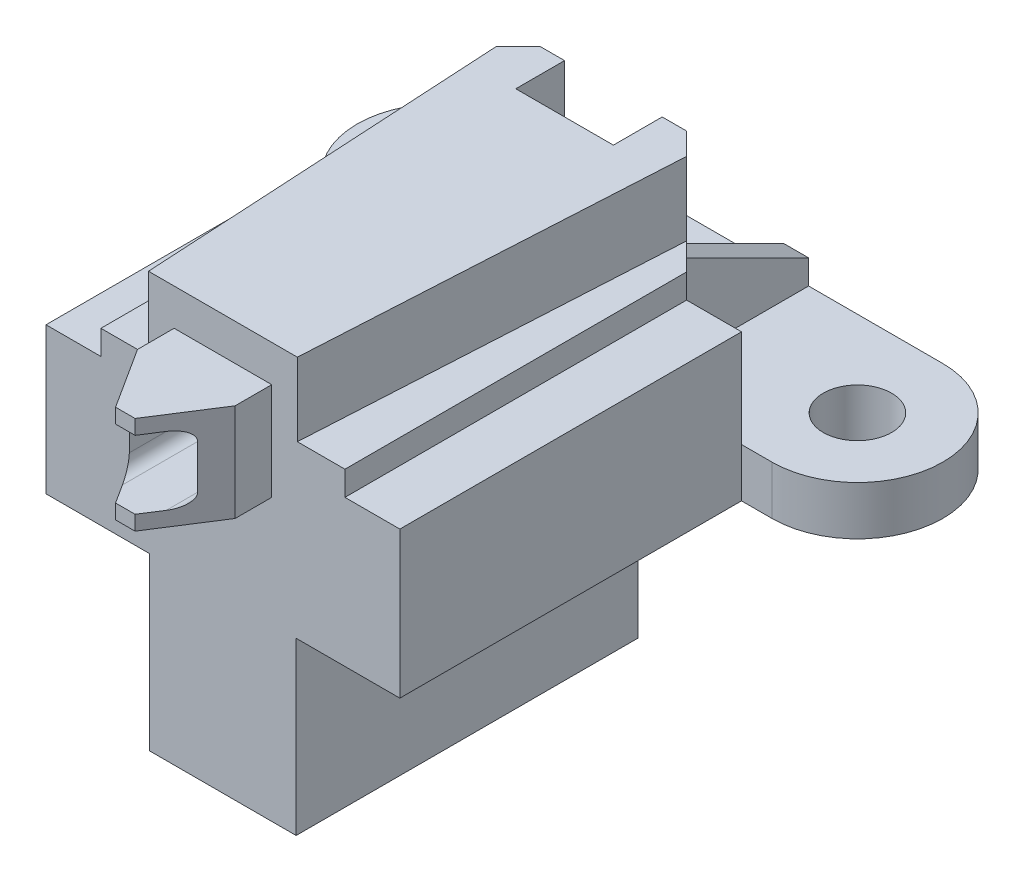
from build123d import *

# Parameters (mm, degrees)
SZKIC1_R                    = 1.4
DODANIE_WYCI_GNI_CIE1_DEPTH = 2
SZKIC1_3_W                  = 4.25
SZKIC1_3_H                  = 14
DODANIE_WYCI_GNI_CIE2_DEPTH = 7
DODANIE_WYCI_GNI_CIE3_DEPTH = 7
SZKIC2_W                    = 10
SZKIC2_H                    = 14
DODANIE_WYCI_GNI_CIE4_DEPTH = 3
DODANIE_WYCI_GNI_CIE5_START = 2
SZKIC1_5_W                  = 1
SZKIC1_5_H                  = 7
DODANIE_WYCI_GNI_CIE5_DEPTH = 3.5
DODANIE_WYCI_GNI_CIE6_REACH = 30.417
WYTNIJ_WYCI_GNI_CIE1_REACH  = 27.125
WYTNIJ_WYCI_GNI_CIE2_DEPTH  = 3
SZKIC6_W                    = 2.25
SZKIC6_H                    = 14
WYTNIJ_WYCI_GNI_CIE3_DEPTH  = 1
SZKIC7_W                    = 4
SZKIC7_H                    = 4
DODANIE_WYCI_GNI_CIE7_DEPTH = 4
WYTNIJ_WYCI_GNI_CIE4_DEPTH  = 4
WYTNIJ_WYCI_GNI_CIE5_DEPTH  = 34.841542518


with BuildPart() as part:
    # Szkic1 → Dodanie-wyciągnięcie1 (new body)
    with BuildSketch(Plane(origin=(0, 0, 0), x_dir=(1, 0, 0), z_dir=(0, 1, 0))):
        with BuildLine():
            Line((-17, 3.5), (0, 3.5))
            ThreePointArc((0, 3.5), (3.5, 0), (0, -3.5))
            Line((0, -3.5), (-17, -3.5))
            ThreePointArc((-17, -3.5), (-20.5, 0), (-17, 3.5))
        make_face()
        with Locations(Location((-17, 0, 0), (0, 0, 270))):
            Circle(SZKIC1_R, mode=Mode.SUBTRACT)
        with Locations(Location((0, 0, 0), (0, 0, 270))):
            Circle(SZKIC1_R, mode=Mode.SUBTRACT)
    extrude(amount=DODANIE_WYCI_GNI_CIE1_DEPTH)

    # Szkic1<3> → Dodanie-wyciągnięcie2 (add)
    with BuildSketch(Plane(origin=(0, 0, 0), x_dir=(1, 0, 0), z_dir=(0, 1, 0))):
        with Locations((-13.625, -10.5)):
            Rectangle(SZKIC1_3_W, SZKIC1_3_H)
        Polygon((-10.5, -3.5), (-11.5, -3.5), (-11.5, -17.5), (-5.5, -17.5), (-5.5, -3.5), (-6.5, -3.5), align=None)
        with Locations((-3.375, -10.5)):
            Rectangle(SZKIC1_3_W, SZKIC1_3_H)
    extrude(amount=DODANIE_WYCI_GNI_CIE2_DEPTH)

    # Szkic1<4> → Dodanie-wyciągnięcie3 (add)
    with BuildSketch(Plane(origin=(0, 0, 0), x_dir=(1, 0, 0), z_dir=(0, 1, 0))):
        Polygon((-10.5, -3.5), (-11.5, -3.5), (-11.5, -17.5), (-5.5, -17.5), (-5.5, -3.5), (-6.5, -3.5), align=None)
    extrude(amount=-DODANIE_WYCI_GNI_CIE3_DEPTH)

    # Szkic2 → Dodanie-wyciągnięcie4 (add)
    with BuildSketch(Plane(origin=(0, 7, 0), x_dir=(1, 0, 0), z_dir=(0, 1, 0))):
        with Locations((-8.5, -10.5)):
            Rectangle(SZKIC2_W, SZKIC2_H)
    extrude(amount=DODANIE_WYCI_GNI_CIE4_DEPTH)

    # Szkic1<5> → Dodanie-wyciągnięcie5 (add)
    with BuildSketch(Plane(origin=(0, 0, 0), x_dir=(1, 0, 0), z_dir=(0, 1, 0)).offset(DODANIE_WYCI_GNI_CIE5_START)):
        with Locations((-6, 0)):
            Rectangle(SZKIC1_5_W, SZKIC1_5_H)
        with Locations((-11, 0)):
            Rectangle(SZKIC1_5_W, SZKIC1_5_H)
    extrude(amount=DODANIE_WYCI_GNI_CIE5_DEPTH)

    # Dodanie-wyciągnięcie6: up to this face of the body (flat: up to its plane)
    dodanie_wyci_gni_cie6_end = Plane(part.part.faces().sort_by_distance((-8.5, 10, 10.5))[0])
    # Szkic3 → Dodanie-wyciągnięcie6 (add, up to the picked face)
    with BuildSketch(Plane(origin=(0, 2, 0), x_dir=(1, 0, 0), z_dir=(0, 1, 0)), mode=Mode.PRIVATE) as dodanie_wyci_gni_cie6_sk1:
        Polygon((-3.5, -3.5), (-5.5, -1.5), (-6.5, -1.5), (-6.5, -3.5), (-5.5, -3.5), align=None)
    dodanie_wyci_gni_cie6_tool1 = split(extrude(dodanie_wyci_gni_cie6_sk1.sketch, amount=DODANIE_WYCI_GNI_CIE6_REACH, mode=Mode.PRIVATE), bisect_by=dodanie_wyci_gni_cie6_end, keep=Keep.BOTH, mode=Mode.PRIVATE)
    # Szkic3 → Dodanie-wyciągnięcie6 (add, up to the picked face)
    with BuildSketch(Plane(origin=(0, 2, 0), x_dir=(1, 0, 0), z_dir=(0, 1, 0)), mode=Mode.PRIVATE) as dodanie_wyci_gni_cie6_sk2:
        Polygon((-11.5, -3.5), (-13.5, -3.5), (-11.5, -1.5), (-10.5, -1.5), (-10.5, -3.5), align=None)
    dodanie_wyci_gni_cie6_tool2 = split(extrude(dodanie_wyci_gni_cie6_sk2.sketch, amount=DODANIE_WYCI_GNI_CIE6_REACH, mode=Mode.PRIVATE), bisect_by=dodanie_wyci_gni_cie6_end, keep=Keep.BOTH, mode=Mode.PRIVATE)
    add(dodanie_wyci_gni_cie6_tool1.solids().sort_by(Axis((-5.416667, 2, 2.666667), (0, 1, 0)))[0])
    add(dodanie_wyci_gni_cie6_tool2.solids().sort_by(Axis((-11.583333, 2, 2.666667), (0, 1, 0)))[0])

    # Wytnij-wyciągnięcie1: up to this face of the body (flat: up to its plane)
    wytnij_wyci_gni_cie1_end = Plane(part.part.faces().sort_by_distance((-5.5, 3.75, -1))[0])
    # Szkic4 → Wytnij-wyciągnięcie1 (cut, up to the picked face)
    with BuildSketch(Plane.ZY.offset(11.5), mode=Mode.PRIVATE) as wytnij_wyci_gni_cie1_sk1:
        Polygon((1.5, 5.5), (-3.5, 3), (-3.5, 5.5), align=None)
    wytnij_wyci_gni_cie1_tool1 = split(extrude(wytnij_wyci_gni_cie1_sk1.sketch, amount=-WYTNIJ_WYCI_GNI_CIE1_REACH, mode=Mode.PRIVATE), bisect_by=wytnij_wyci_gni_cie1_end, keep=Keep.BOTH, mode=Mode.PRIVATE)
    add(wytnij_wyci_gni_cie1_tool1.solids().sort_by(Axis((-11.5, 4.666667, -1.833333), (1, 0, 0)))[0], mode=Mode.SUBTRACT)

    # Szkic5 → Wytnij-wyciągnięcie2 (cut)
    with BuildSketch(Plane(origin=(0, 10, 0), x_dir=(1, 0, 0), z_dir=(0, 1, 0))):
        Polygon((-5.45, -17.5), (-3.5, -17.5), (-3.5, -3.5), (-4.600591716, -2.399408284), align=None)
        Polygon((-13.5, -3.5), (-12.399408284, -2.399408284), (-11.55, -17.5), (-13.5, -17.5), align=None)
    extrude(amount=-WYTNIJ_WYCI_GNI_CIE2_DEPTH, mode=Mode.SUBTRACT)

    # Szkic6 → Wytnij-wyciągnięcie3 (cut)
    with BuildSketch(Plane(origin=(0, 7, 0), x_dir=(1, 0, 0), z_dir=(0, 1, 0))):
        with Locations((-2.375, -10.5)):
            Rectangle(SZKIC6_W, SZKIC6_H)
        with Locations((-14.625, -10.5)):
            Rectangle(SZKIC6_W, SZKIC6_H)
    extrude(amount=-WYTNIJ_WYCI_GNI_CIE3_DEPTH, mode=Mode.SUBTRACT)

    # Szkic7 → Dodanie-wyciągnięcie7 (add)
    with BuildSketch(Plane.XY.offset(17.5)):
        with Locations((-8.5, 6.5)):
            Rectangle(SZKIC7_W, SZKIC7_H)
    extrude(amount=DODANIE_WYCI_GNI_CIE7_DEPTH)

    # Szkic8 → Wytnij-wyciągnięcie4 (cut)
    with BuildSketch(Plane(origin=(0, 8.5, 0), x_dir=(1, 0, 0), z_dir=(0, 1, 0))):
        Polygon((-8.1, -21.5), (-6.5, -19), (-6.5, -21.5), align=None)
        Polygon((-8.9, -21.5), (-10.5, -19), (-10.5, -21.5), align=None)
    extrude(amount=-WYTNIJ_WYCI_GNI_CIE4_DEPTH, mode=Mode.SUBTRACT)

    # Szkic9 → Wytnij-wyciągnięcie5 (cut, through all)
    with BuildSketch(Plane.XY.offset(21.5)):
        with BuildLine():
            Line((-7.6, 7.9), (-9.4, 7.9))
            ThreePointArc((-9.4, 7.9), (-9.753553391, 7.753553391), (-9.9, 7.4))
            Line((-9.9, 7.4), (-9.9, 5.6))
            ThreePointArc((-9.9, 5.6), (-9.753553391, 5.246446609), (-9.4, 5.1))
            Line((-9.4, 5.1), (-7.6, 5.1))
            ThreePointArc((-7.6, 5.1), (-7.246446609, 5.246446609), (-7.1, 5.6))
            Line((-7.1, 5.6), (-7.1, 7.4))
            ThreePointArc((-7.1, 7.4), (-7.246446609, 7.753553391), (-7.6, 7.9))
        make_face()
    extrude(amount=-WYTNIJ_WYCI_GNI_CIE5_DEPTH, mode=Mode.SUBTRACT)


solid = part.part
